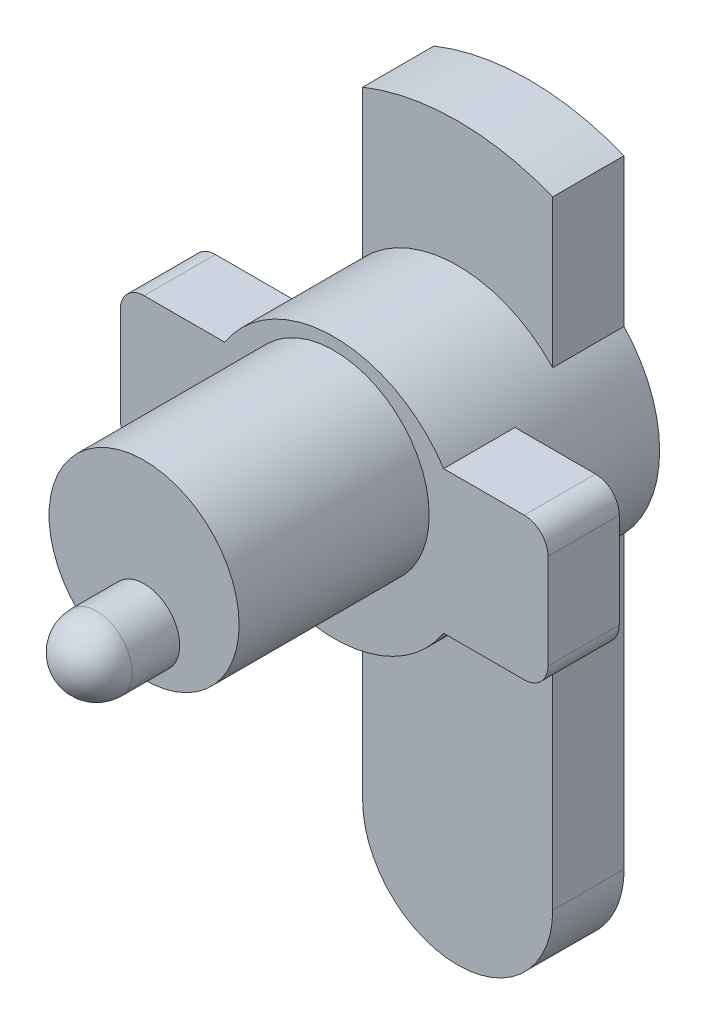
from build123d import *

# Parameters (mm, degrees)
SCHIZZO1_R                   = 2.75
ESTRUSIONE_ESTRUSIONE1_DEPTH = 4.1
SCHIZZO2_W                   = 9
SCHIZZO2_H                   = 3
ESTRUSIONE_ESTRUSIONE2_DEPTH = 1.5
RACCORDO1_R                  = 0.5
SCHIZZO3_R                   = 2
ESTRUSIONE_ESTRUSIONE3_DEPTH = 4
SCHIZZO4_R                   = 0.75
ESTRUSIONE_ESTRUSIONE4_DEPTH = 1
RIVOLUZIONE1_ANGLE           = 180
ESTRUSIONE_ESTRUSIONE5_DEPTH = 1.5
SCHIZZO7_R                   = 1.5
TAGLIO_ESTRUSIONE2_DEPTH     = 3.1
SCHIZZO8_R                   = 0.5
TAGLIO_ESTRUSIONE5_DEPTH     = 4
ESTRUSIONE_ESTRUSIONE6_DEPTH = 0.3
RACCORDO5_R                  = 0.1


with BuildPart() as part:
    # Schizzo1 → Estrusione-Estrusione1 (new body)
    with BuildSketch(Plane.XY):
        Circle(SCHIZZO1_R)
    extrude(amount=ESTRUSIONE_ESTRUSIONE1_DEPTH)

    # Schizzo2 → Estrusione-Estrusione2 (add)
    with BuildSketch(Plane.XY.offset(4.1)):
        Rectangle(SCHIZZO2_W, SCHIZZO2_H)
    extrude(amount=-ESTRUSIONE_ESTRUSIONE2_DEPTH)

    # Raccordo1
    raccordo1_edges = [part.edges().sort_by_distance(p)[0] for p in [
        (4.5, -1.5, 3.35),
        (-4.5, 1.5, 3.35),
        (4.5, 1.5, 3.35),
        (-4.5, -1.5, 3.35),
    ]]
    fillet(raccordo1_edges, radius=RACCORDO1_R)

    # Schizzo3 → Estrusione-Estrusione3 (add)
    with BuildSketch(Plane.XY.offset(4.1)):
        with Locations((0, 0.5)):
            Circle(SCHIZZO3_R)
    extrude(amount=ESTRUSIONE_ESTRUSIONE3_DEPTH)

    # Schizzo4 → Estrusione-Estrusione4 (add)
    with BuildSketch(Plane.XY.offset(8.1)):
        with Locations((0, -0.5)):
            Circle(SCHIZZO4_R)
    extrude(amount=ESTRUSIONE_ESTRUSIONE4_DEPTH)

    # Schizzo5 → Rivoluzione1 (revolve)
    with BuildSketch(Plane.XY.offset(9.1)):
        with BuildLine():
            Line((0, 0.25), (0, -1.25))
            ThreePointArc((0, -1.25), (0.75, -0.5), (0, 0.25))
        make_face()
    revolve(axis=Axis((0, 0.25, 9.1), (0, -1, 0)), revolution_arc=RIVOLUZIONE1_ANGLE)

    # Schizzo6 → Estrusione-Estrusione5 (add)
    with BuildSketch(Plane.XY):
        with BuildLine():
            Line((-2, -8), (-2, 5))
            ThreePointArc((-2, 5), (0, 5.385164807), (2, 5))
            Line((2, 5), (2, -8))
            ThreePointArc((2, -8), (0, -10), (-2, -8))
        make_face()
    extrude(amount=ESTRUSIONE_ESTRUSIONE5_DEPTH)

    # Schizzo7 → Taglio-Estrusione2 (cut)
    with BuildSketch(Plane(origin=(0, 0, 0), x_dir=(-1, 0, 0), z_dir=(0, 0, -1))):
        with Locations((0, 0.5)):
            Circle(SCHIZZO7_R)
    extrude(amount=-TAGLIO_ESTRUSIONE2_DEPTH, mode=Mode.SUBTRACT)

    # Schizzo8 → Taglio-Estrusione5 (cut)
    with BuildSketch(Plane(origin=(0, 0, 3.1), x_dir=(-1, 0, 0), z_dir=(0, 0, -1))):
        with Locations((0, 0.5)):
            Circle(SCHIZZO8_R)
    extrude(amount=-TAGLIO_ESTRUSIONE5_DEPTH, mode=Mode.SUBTRACT)

    # Schizzo9 → Estrusione-Estrusione6 (add)
    with BuildSketch(Plane(origin=(0, 0, 0), x_dir=(-1, 0, 0), z_dir=(0, 0, -1))):
        with BuildLine():
            Line((-0.5, -9.5), (-0.5, -1.5))
            ThreePointArc((-0.5, -1.5), (0, -1), (0.5, -1.5))
            Line((0.5, -1.5), (0.5, -9.5))
            ThreePointArc((0.5, -9.5), (0, -10), (-0.5, -9.5))
        make_face()
    extrude(amount=ESTRUSIONE_ESTRUSIONE6_DEPTH)

    # Raccordo5
    raccordo5_edges = [part.edges().sort_by_distance(p)[0] for p in [
        (0, -10, -0.3),
        (-0.5, -5.5, -0.3),
        (0, -1, -0.3),
        (0.5, -5.5, -0.3),
    ]]
    fillet(raccordo5_edges, radius=RACCORDO5_R)


solid = part.part
